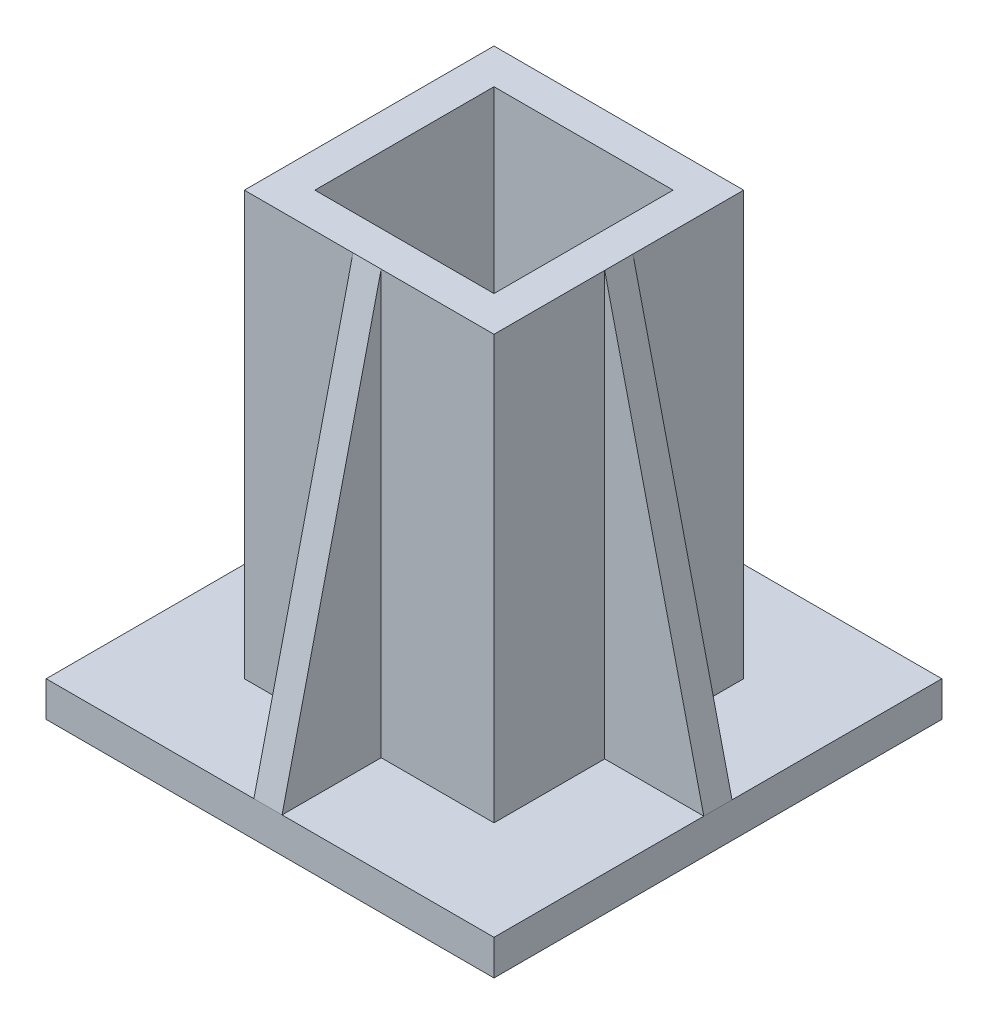
from build123d import *

# Parameters (mm, degrees)
SKETCH1_W               = 63.5
SKETCH1_H               = 63.5
BOSS_EXTRUDE1_DEPTH     = 5
SKETCH2_W               = 35.4
SKETCH2_H               = 35.4
SKETCH2_W_2             = 25.4
SKETCH2_H_2             = 25.4
BOSS_EXTRUDE2_DEPTH     = 60
SKETCH13_W              = 14.05
SKETCH13_H              = 4
BOSS_EXTRUDE3_DEPTH     = 60
CUT_EXTRUDE1_DEPTH      = 80.825591135
CUT_EXTRUDE1_DEPTH_BACK = 80.825591135
SKETCH15_W              = 14.05
SKETCH15_H              = 4
BOSS_EXTRUDE4_DEPTH     = 60
CUT_EXTRUDE3_DEPTH      = 80.825591135
CUT_EXTRUDE3_DEPTH_BACK = 80.825591135
SKETCH17_W              = 4
SKETCH17_H              = 14.05
BOSS_EXTRUDE5_DEPTH     = 60
CUT_EXTRUDE4_DEPTH      = 80.95289238
CUT_EXTRUDE4_DEPTH_BACK = 80.95289238
SKETCH21_R              = 3.175
CUT_EXTRUDE7_DEPTH      = 20


with BuildPart() as part:
    # Sketch1 → Boss-Extrude1 (new body)
    with BuildSketch(Plane(origin=(0, 0, 0), x_dir=(1, 0, 0), z_dir=(0, 1, 0))):
        Rectangle(SKETCH1_W, SKETCH1_H)
    extrude(amount=BOSS_EXTRUDE1_DEPTH)

    # Sketch2 → Boss-Extrude2 (add)
    with BuildSketch(Plane(origin=(0, 5, 0), x_dir=(1, 0, 0), z_dir=(0, 1, 0))):
        Rectangle(SKETCH2_W, SKETCH2_H)
        Rectangle(SKETCH2_W_2, SKETCH2_H_2, mode=Mode.SUBTRACT)
    extrude(amount=BOSS_EXTRUDE2_DEPTH)

    # Sketch13 → Boss-Extrude3 (add)
    with BuildSketch(Plane(origin=(0, 5, 0), x_dir=(1, 0, 0), z_dir=(0, 1, 0))):
        with Locations((-24.725, 0)):
            Rectangle(SKETCH13_W, SKETCH13_H)
    extrude(amount=BOSS_EXTRUDE3_DEPTH)

    # Sketch14 → Cut-Extrude1 (cut, two sides: drawn at the far end of the back side and taken through both)
    with BuildSketch(Plane.XY.offset(2).offset(-CUT_EXTRUDE1_DEPTH_BACK)):
        Polygon((-73.867235452, -174.860080223), (-31.75, 5), (-17.7, 65), (24.417235452, 244.860080223), (-335.302924994, 329.094551127), (-433.587395898, -90.625609319), align=None)
    extrude(amount=CUT_EXTRUDE1_DEPTH + CUT_EXTRUDE1_DEPTH_BACK, mode=Mode.SUBTRACT)

    # Sketch15 → Boss-Extrude4 (add)
    with BuildSketch(Plane(origin=(0, 5, 0), x_dir=(1, 0, 0), z_dir=(0, 1, 0))):
        with Locations((24.725, 0)):
            Rectangle(SKETCH15_W, SKETCH15_H)
    extrude(amount=BOSS_EXTRUDE4_DEPTH)

    # Sketch16 → Cut-Extrude3 (cut, two sides: drawn at the far end of the back side and taken through both)
    with BuildSketch(Plane.XY.offset(2).offset(-CUT_EXTRUDE3_DEPTH_BACK)):
        Polygon((73.867235452, -174.860080223), (31.75, 5), (17.7, 65), (-24.417235452, 244.860080223), (335.302924994, 329.094551127), (433.587395898, -90.625609319), align=None)
    extrude(amount=CUT_EXTRUDE3_DEPTH + CUT_EXTRUDE3_DEPTH_BACK, mode=Mode.SUBTRACT)

    # Sketch17 → Boss-Extrude5 (add)
    with BuildSketch(Plane(origin=(0, 5, 0), x_dir=(1, 0, 0), z_dir=(0, 1, 0))):
        with Locations((-0.3, -24.725)):
            Rectangle(SKETCH17_W, SKETCH17_H)
    extrude(amount=BOSS_EXTRUDE5_DEPTH)

    # Sketch18 → Cut-Extrude4 (cut, two sides: drawn at the far end of the back side and taken through both)
    with BuildSketch(Plane.ZY.offset(2.3).offset(-CUT_EXTRUDE4_DEPTH_BACK)):
        Polygon((73.867235452, -174.860080223), (31.75, 5), (17.7, 65), (-24.417235452, 244.860080223), (335.302924994, 329.094551127), (433.587395898, -90.625609319), align=None)
    extrude(amount=CUT_EXTRUDE4_DEPTH + CUT_EXTRUDE4_DEPTH_BACK, mode=Mode.SUBTRACT)

    # Sketch21 → Cut-Extrude7 (cut)
    with BuildSketch(Plane(origin=(0, 0, -17.7), x_dir=(-1, 0, 0), z_dir=(0, 0, -1))):
        with Locations((0, 17.739365868)):
            Circle(SKETCH21_R)
        with Locations((0, 47.466444019)):
            Circle(SKETCH21_R)
    extrude(amount=-CUT_EXTRUDE7_DEPTH, mode=Mode.SUBTRACT)


solid = part.part
